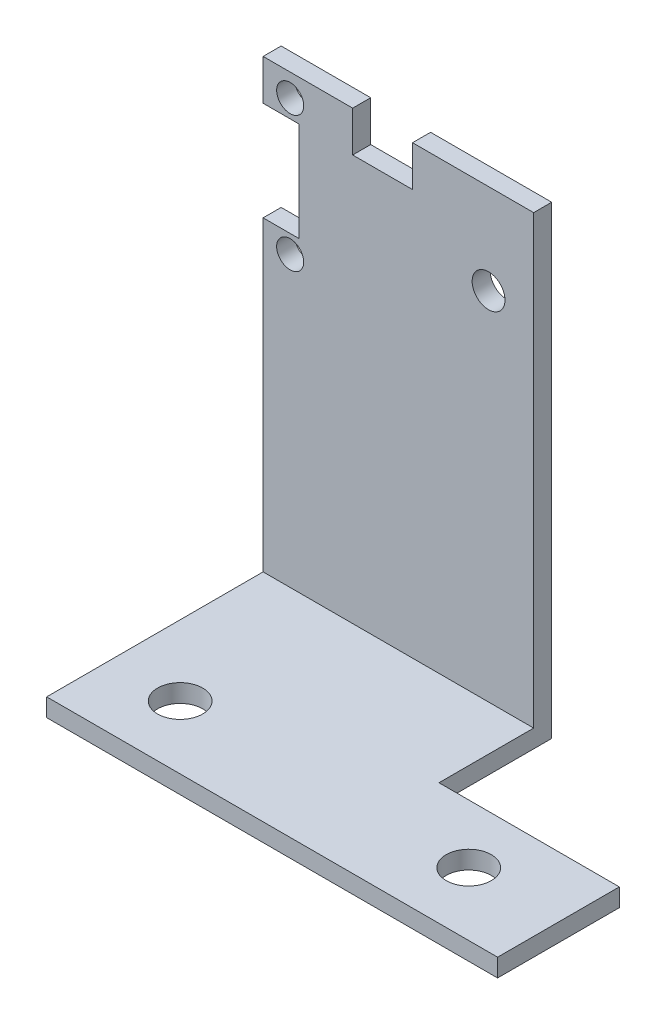
from build123d import *

# Parameters (mm, degrees)
SKIZZE1_W                       = 50
SKIZZE1_H                       = 26
SKIZZE1_R                       = 2.5
AUFSATZ_LINEAR_AUSTRAGEN1_DEPTH = 2
SKIZZE2_W                       = 30
SKIZZE2_H                       = 2
AUFSATZ_LINEAR_AUSTRAGEN2_DEPTH = 49.5
SKIZZE3_R                       = 1.5
SKIZZE3_R_2                     = 1.822550398
SKIZZE3_W                       = 4
SKIZZE3_H                       = 11
SKIZZE3_W_2                     = 6.639290737
SKIZZE3_H_2                     = 4.5
SCHNITT_LINEAR_AUSTRAGEN1_DEPTH = 49.5
SKIZZE4_W                       = 20
SKIZZE4_H                       = 12.5
SCHNITT_LINEAR_AUSTRAGEN2_DEPTH = 49.5


with BuildPart() as part:
    # Skizze1 → Aufsatz-Linear austragen1 (new body)
    with BuildSketch(Plane(origin=(0, 0, 0), x_dir=(1, 0, 0), z_dir=(0, 1, 0))):
        Rectangle(SKIZZE1_W, SKIZZE1_H)
        with Locations(Location((14.802393345, -6, 0), (0, 0, 270))):
            Circle(SKIZZE1_R, mode=Mode.SUBTRACT)
        with Locations(Location((-17.197606655, -6, 0), (0, 0, 270))):
            Circle(SKIZZE1_R, mode=Mode.SUBTRACT)
    extrude(amount=AUFSATZ_LINEAR_AUSTRAGEN1_DEPTH)

    # Skizze2 → Aufsatz-Linear austragen2 (add)
    with BuildSketch(Plane(origin=(0, 2, 0), x_dir=(1, 0, 0), z_dir=(0, 1, 0))):
        with Locations((-10, 12)):
            Rectangle(SKIZZE2_W, SKIZZE2_H)
    extrude(amount=AUFSATZ_LINEAR_AUSTRAGEN2_DEPTH)

    # Skizze3 → Schnitt-Linear austragen1 (cut)
    with BuildSketch(Plane.XY.offset(-11)):
        with Locations((-22, 49)):
            Circle(SKIZZE3_R)
        with Locations((-22, 34)):
            Circle(SKIZZE3_R)
        with Locations((0, 41.5)):
            Circle(SKIZZE3_R_2)
        with Locations((-23, 41.5)):
            Rectangle(SKIZZE3_W, SKIZZE3_H)
        with Locations((-11.748940962, 49.25)):
            Rectangle(SKIZZE3_W_2, SKIZZE3_H_2)
    extrude(amount=-SCHNITT_LINEAR_AUSTRAGEN1_DEPTH, mode=Mode.SUBTRACT)

    # Skizze4 → Schnitt-Linear austragen2 (cut)
    with BuildSketch(Plane(origin=(0, 2, 0), x_dir=(1, 0, 0), z_dir=(0, 1, 0))):
        with Locations((15, 6.75)):
            Rectangle(SKIZZE4_W, SKIZZE4_H)
    extrude(amount=-SCHNITT_LINEAR_AUSTRAGEN2_DEPTH, mode=Mode.SUBTRACT)


solid = part.part
